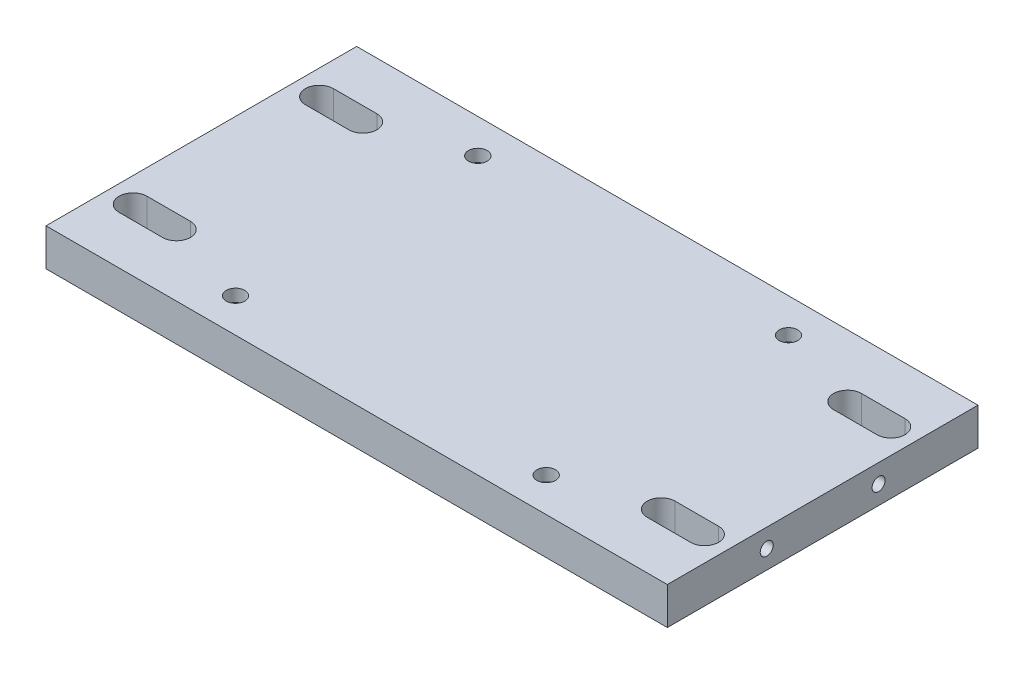
from build123d import *

# Parameters (mm, degrees)
SKETCH1_W                                       = 200
SKETCH1_H                                       = 100
BOSS_EXTRUDE1_DEPTH                             = 12
CUT_EXTRUDE1_DEPTH                              = 207.504237245
CBORE_FOR_M5_SOCKET_HEAD_CAP_SCREW1_D           = 6
CBORE_FOR_M5_SOCKET_HEAD_CAP_SCREW1_CBORE_D     = 11
CBORE_FOR_M5_SOCKET_HEAD_CAP_SCREW1_CBORE_DEPTH = 8
M5X0_8_TAPPED_HOLE1_D                           = 4.2
M5X0_8_TAPPED_HOLE1_DEPTH                       = 14
M5X0_8_TAPPED_HOLE1_TIP                         = 1.2618073


with BuildPart() as part:
    # Sketch1 → Boss-Extrude1 (new body)
    with BuildSketch(Plane(origin=(0, 0, 0), x_dir=(1, 0, 0), z_dir=(0, 1, 0))):
        with Locations((-100, 0)):
            Rectangle(SKETCH1_W, SKETCH1_H)
    extrude(amount=BOSS_EXTRUDE1_DEPTH)

    # Sketch2 → Cut-Extrude1 (cut, through all)
    with BuildSketch(Plane(origin=(0, 12, 0), x_dir=(1, 0, 0), z_dir=(0, 1, 0))):
        with BuildLine():
            Line((-192, -25.5), (-178, -25.5))
            ThreePointArc((-178, -25.5), (-173.5, -30), (-178, -34.5))
            Line((-178, -34.5), (-192, -34.5))
            ThreePointArc((-192, -34.5), (-196.5, -30), (-192, -25.5))
        make_face()
        with BuildLine():
            Line((-192, 34.5), (-178, 34.5))
            ThreePointArc((-178, 34.5), (-173.5, 30), (-178, 25.5))
            Line((-178, 25.5), (-192, 25.5))
            ThreePointArc((-192, 25.5), (-196.5, 30), (-192, 34.5))
        make_face()
        with BuildLine():
            Line((-22, 34.5), (-8, 34.5))
            ThreePointArc((-8, 34.5), (-3.5, 30), (-8, 25.5))
            Line((-8, 25.5), (-22, 25.5))
            ThreePointArc((-22, 25.5), (-26.5, 30), (-22, 34.5))
        make_face()
        with BuildLine():
            Line((-22, -25.5), (-8, -25.5))
            ThreePointArc((-8, -25.5), (-3.5, -30), (-8, -34.5))
            Line((-8, -34.5), (-22, -34.5))
            ThreePointArc((-22, -34.5), (-26.5, -30), (-22, -25.5))
        make_face()
    extrude(amount=-CUT_EXTRUDE1_DEPTH, mode=Mode.SUBTRACT)

    # CBORE for M5 Socket Head Cap Screw1 (through all)
    with Locations(Plane.XZ):
        with Locations((-150, 39), (-50, 39), (-150, -39), (-50, -39)):
            CounterBoreHole(CBORE_FOR_M5_SOCKET_HEAD_CAP_SCREW1_D / 2, CBORE_FOR_M5_SOCKET_HEAD_CAP_SCREW1_CBORE_D / 2, CBORE_FOR_M5_SOCKET_HEAD_CAP_SCREW1_CBORE_DEPTH)

    # M5x0.8 Tapped Hole1
    with Locations(Plane(origin=(0, 0, 0), x_dir=(0, 0, -1), z_dir=(1, 0, 0))):
        with Locations((18, 6), (-18, 6)):
            Hole(M5X0_8_TAPPED_HOLE1_D / 2, depth=M5X0_8_TAPPED_HOLE1_DEPTH)
            with Locations((0, 0, -(M5X0_8_TAPPED_HOLE1_DEPTH + M5X0_8_TAPPED_HOLE1_TIP / 2))):  # 118° drill point
                Cone(0, M5X0_8_TAPPED_HOLE1_D / 2, M5X0_8_TAPPED_HOLE1_TIP, mode=Mode.SUBTRACT)


solid = part.part
